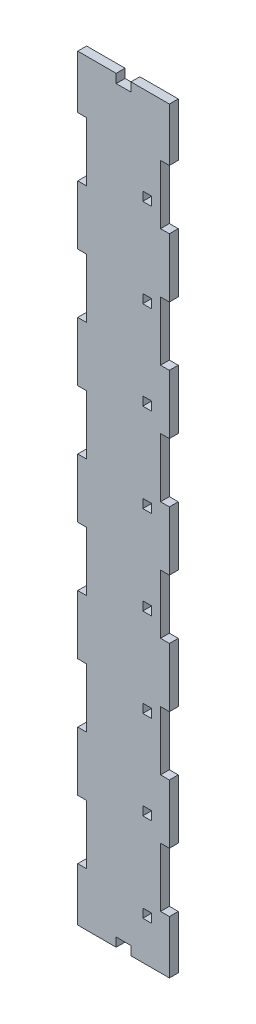
from build123d import *

# Parameters (mm, degrees)
SKETCH2_W           = 3
SKETCH2_H           = 3
BOSS_EXTRUDE2_DEPTH = 3


with BuildPart() as part:
    # Sketch2 → Boss-Extrude2 (new body)
    with BuildSketch(Plane.XY):
        Polygon((10, 250), (15, 250), (15, 253), (25, 253), (28, 253), (28, 235), (25, 235), (25, 215), (28, 215), (28, 195), (25, 195), (25, 175), (28, 175), (28, 155), (25, 155), (25, 135), (28, 135), (28, 115), (25, 115), (25, 95), (28, 95), (28, 75), (25, 75), (25, 55), (28, 55), (28, 35), (25, 35), (25, 15), (28, 15), (28, -3), (25, -3), (15, -3), (15, 0), (10, 0), (10, -3), (0, -3), (-3, -3), (-3, 15), (0, 15), (0, 35), (-3, 35), (-3, 55), (0, 55), (0, 75), (-3, 75), (-3, 95), (0, 95), (0, 115), (-3, 115), (-3, 135), (0, 135), (0, 155), (-3, 155), (-3, 175), (0, 175), (0, 195), (-3, 195), (-3, 215), (0, 215), (0, 235), (-3, 235), (-3, 253), (0, 253), (10, 253), align=None)
        with Locations((20.5, 191.5)):
            Rectangle(SKETCH2_W, SKETCH2_H, mode=Mode.SUBTRACT)
        with Locations((20.5, 221.5)):
            Rectangle(SKETCH2_W, SKETCH2_H, mode=Mode.SUBTRACT)
        with Locations((20.5, 161.5)):
            Rectangle(SKETCH2_W, SKETCH2_H, mode=Mode.SUBTRACT)
        with Locations((20.5, 131.5)):
            Rectangle(SKETCH2_W, SKETCH2_H, mode=Mode.SUBTRACT)
        with Locations((20.5, 101.5)):
            Rectangle(SKETCH2_W, SKETCH2_H, mode=Mode.SUBTRACT)
        with Locations((20.5, 71.5)):
            Rectangle(SKETCH2_W, SKETCH2_H, mode=Mode.SUBTRACT)
        with Locations((20.5, 41.5)):
            Rectangle(SKETCH2_W, SKETCH2_H, mode=Mode.SUBTRACT)
        with Locations((20.5, 11.5)):
            Rectangle(SKETCH2_W, SKETCH2_H, mode=Mode.SUBTRACT)
    extrude(amount=BOSS_EXTRUDE2_DEPTH)


solid = part.part
